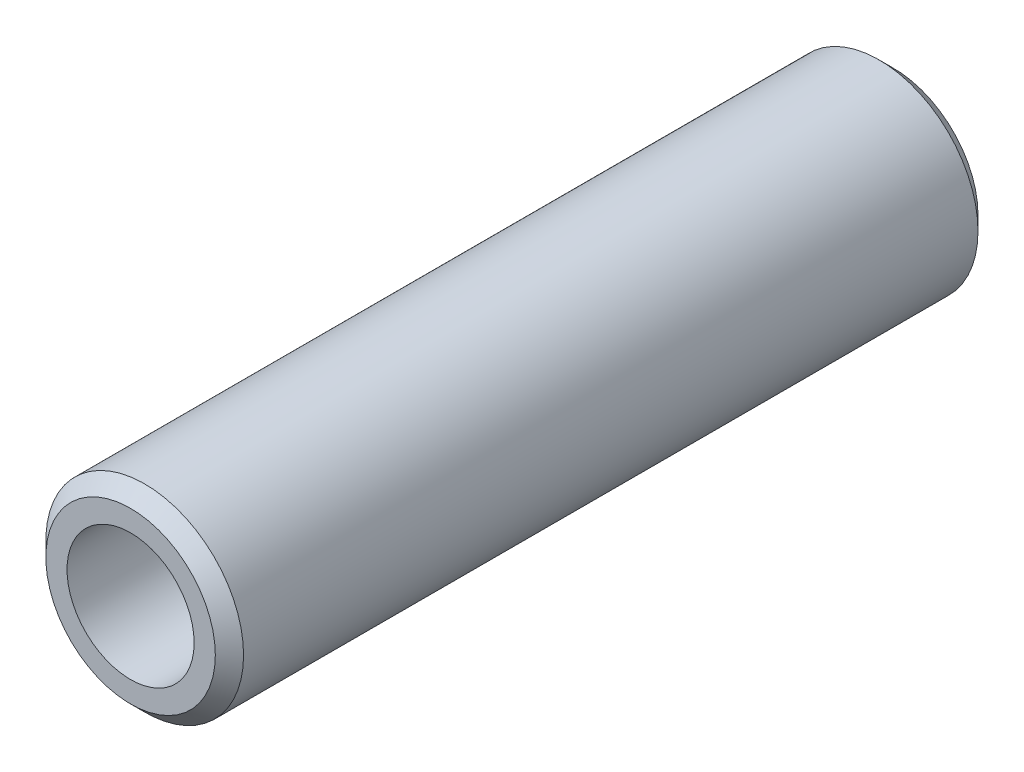
from build123d import *

# Parameters (mm, degrees)
ESQUISSE1_R        = 35
ESQUISSE1_R_2      = 22.5
BOSS_EXTRU_1_DEPTH = 135
CHANFREIN1_SIZE    = 5


with BuildPart() as part:
    # Esquisse1 → Boss.-Extru.1 (new, symmetric)
    with BuildSketch(Plane.XY):
        Circle(ESQUISSE1_R)
        Circle(ESQUISSE1_R_2, mode=Mode.SUBTRACT)
    extrude(amount=BOSS_EXTRU_1_DEPTH, both=True)

    # Chanfrein1
    chanfrein1_edges = [part.edges().sort_by_distance(p)[0] for p in [
        (-35, 0, -135),
        (-35, 0, 135),
    ]]
    chamfer(chanfrein1_edges, length=CHANFREIN1_SIZE)


solid = part.part
